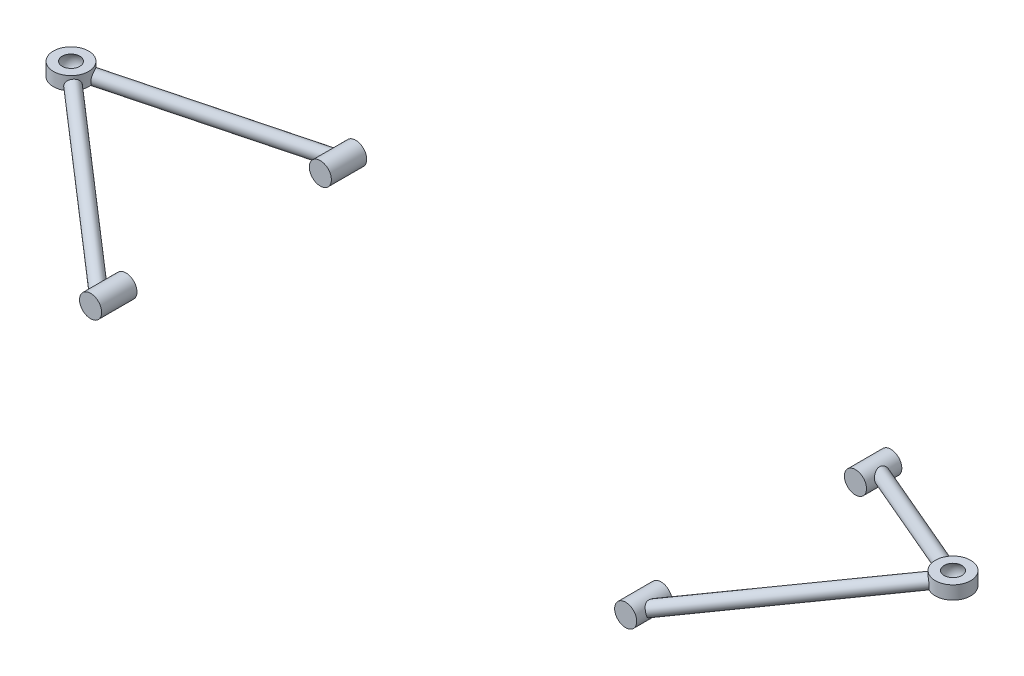
from build123d import *
from build123d.topology import SkipClean

# Parameters (mm, degrees)
SKETCH1_R           = 12.5
BOSS_EXTRUDE1_DEPTH = 40
SKETCH2_R           = 12.5
BOSS_EXTRUDE2_DEPTH = 40
SKETCH3_R           = 20
SKETCH3_R_2         = 12.5
BOSS_EXTRUDE3_DEPTH = 7.5
SWEEP1_PROFILE_R    = 7.5


with BuildPart() as part:
    # Sketch1 → Boss-Extrude1 (new body)
    with BuildSketch(Plane(origin=(0, 0, -1475), x_dir=(-1, 0, 0), z_dir=(0, 0, -1))):
        with Locations(Location((-302.769498028, 342.055200897, 0), (0, 0, 180))):
            Circle(SKETCH1_R)
    extrude(amount=BOSS_EXTRUDE1_DEPTH)



with BuildPart() as body_2:
    # Sketch2 → Boss-Extrude2 (new body)
    with BuildSketch(Plane(origin=(0, 0, -1735), x_dir=(-1, 0, 0), z_dir=(0, 0, -1))):
        with Locations(Location((-302.769498028, 342.055200897, 0), (0, 0, 180))):
            Circle(SKETCH2_R)
    extrude(amount=BOSS_EXTRUDE2_DEPTH)


with BuildPart() as body_3:
    # Sketch3 → Boss-Extrude3 (new, symmetric)
    # profile 1 of 5: a face of its own
    with BuildSketch(Plane(origin=(0, 389.236844361, 0), x_dir=(1, 0, 0), z_dir=(0, 1, 0))):
        with Locations(Location((499.05415, 1649.136745287, 0), (0, 0, 270))):
            Circle(SKETCH3_R)
        with Locations((499.05415, 1649.136745287)):
            Circle(SKETCH3_R_2, mode=Mode.SUBTRACT)
    # profile 2 of 5: a face of its own
    with BuildSketch(Plane(origin=(0, 389.236844361, 0), x_dir=(1, 0, 0), z_dir=(0, 1, 0))):
        with BuildLine():
            Line((499.05415, 1636.636745287), (499.05415, 1661.636745287))
            ThreePointArc((499.05415, 1661.636745287), (486.55415, 1649.136745287), (499.05415, 1636.636745287))
        make_face()
    # profile 3 of 5: a face of its own
    with BuildSketch(Plane(origin=(0, 389.236844361, 0), x_dir=(1, 0, 0), z_dir=(0, 1, 0))):
        with BuildLine():
            ThreePointArc((511.55415, 1649.136745287), (507.892984765, 1657.975580052), (499.05415, 1661.636745287))
            Line((499.05415, 1661.636745287), (499.05415, 1636.636745287))
            ThreePointArc((499.05415, 1636.636745287), (507.892984765, 1640.297910522), (511.55415, 1649.136745287))
        make_face()
    # profile 4 of 5: a face of its own
    with BuildSketch(Plane(origin=(0, 389.236844361, 0), x_dir=(1, 0, 0), z_dir=(0, 1, 0))):
        with BuildLine():
            Line((499.05415, 1636.636745287), (499.05415, 1661.636745287))
            ThreePointArc((499.05415, 1661.636745287), (486.55415, 1649.136745287), (499.05415, 1636.636745287))
        make_face()
    # profile 5 of 5: a face of its own
    with BuildSketch(Plane(origin=(0, 389.236844361, 0), x_dir=(1, 0, 0), z_dir=(0, 1, 0))):
        with BuildLine():
            ThreePointArc((511.55415, 1649.136745287), (507.892984765, 1657.975580052), (499.05415, 1661.636745287))
            Line((499.05415, 1661.636745287), (499.05415, 1636.636745287))
            ThreePointArc((499.05415, 1636.636745287), (507.892984765, 1640.297910522), (511.55415, 1649.136745287))
        make_face()
    extrude(amount=BOSS_EXTRUDE3_DEPTH, both=True)


with BuildPart() as part_1:
    add(part.part)

    add(body_2.part)  # Sweep1 merges body 2

    add(body_3.part)  # Sweep1 merges body 3
    # Sweep1: sweep along a curve in space
    with BuildLine() as sweep1_path:
        Line((302.769498028, 342.055200897, -1485), (499.05415, 389.236844361, -1649.136745287))
        Line((499.05415, 389.236844361, -1649.136745287), (302.769498028, 342.055200897, -1760))
    # Sweep1 profile (on start of the path) → Sweep1 (sweep)
    with BuildSketch(Plane(origin=(302.769498028, 342.055200897, -1485), x_dir=(0.6414894281886279, 0, 0.7671318749225763), z_dir=(0.7544130466642287, 0.1813409608669947, -0.6308537159553169))):
        Circle(SWEEP1_PROFILE_R)
    sweep(path=sweep1_path.line, transition=Transition.RIGHT)

    # Sketch3<3> → Cut-Revolve1 (revolve, cut)
    with SkipClean():  # the faces are left unmerged after this step: merging them gives an invalid solid
        with BuildSketch(Plane(origin=(0, 389.236844361, 0), x_dir=(1, 0, 0), z_dir=(0, 1, 0)), mode=Mode.PRIVATE) as cut_revolve1_sk:
            with BuildLine():
                ThreePointArc((511.55415, 1649.136745287), (507.892984765, 1657.975580052), (499.05415, 1661.636745287))
                Line((499.05415, 1661.636745287), (499.05415, 1636.636745287))
                ThreePointArc((499.05415, 1636.636745287), (507.892984765, 1640.297910522), (511.55415, 1649.136745287))
            make_face()
            with BuildLine():
                Line((499.05415, 1636.636745287), (499.05415, 1661.636745287))
                ThreePointArc((499.05415, 1661.636745287), (486.55415, 1649.136745287), (499.05415, 1636.636745287))
            make_face()
        revolve(cut_revolve1_sk.sketch.rotate(Axis((499.05415, 389.236844361, -1661.636745287), (0, 0, 1)), 180.001451162), axis=Axis((499.05415, 389.236844361, -1661.636745287), (0, 0, 1)), mode=Mode.SUBTRACT)


with BuildPart() as body_2_2:
    # Mirror2: mirrored copy
    add(part_1.part.mirror(Plane(origin=(0, 0, 0), x_dir=(0, 0, 1), z_dir=(1, 0, 0))))


solid = Compound([part_1.part, body_2_2.part])
